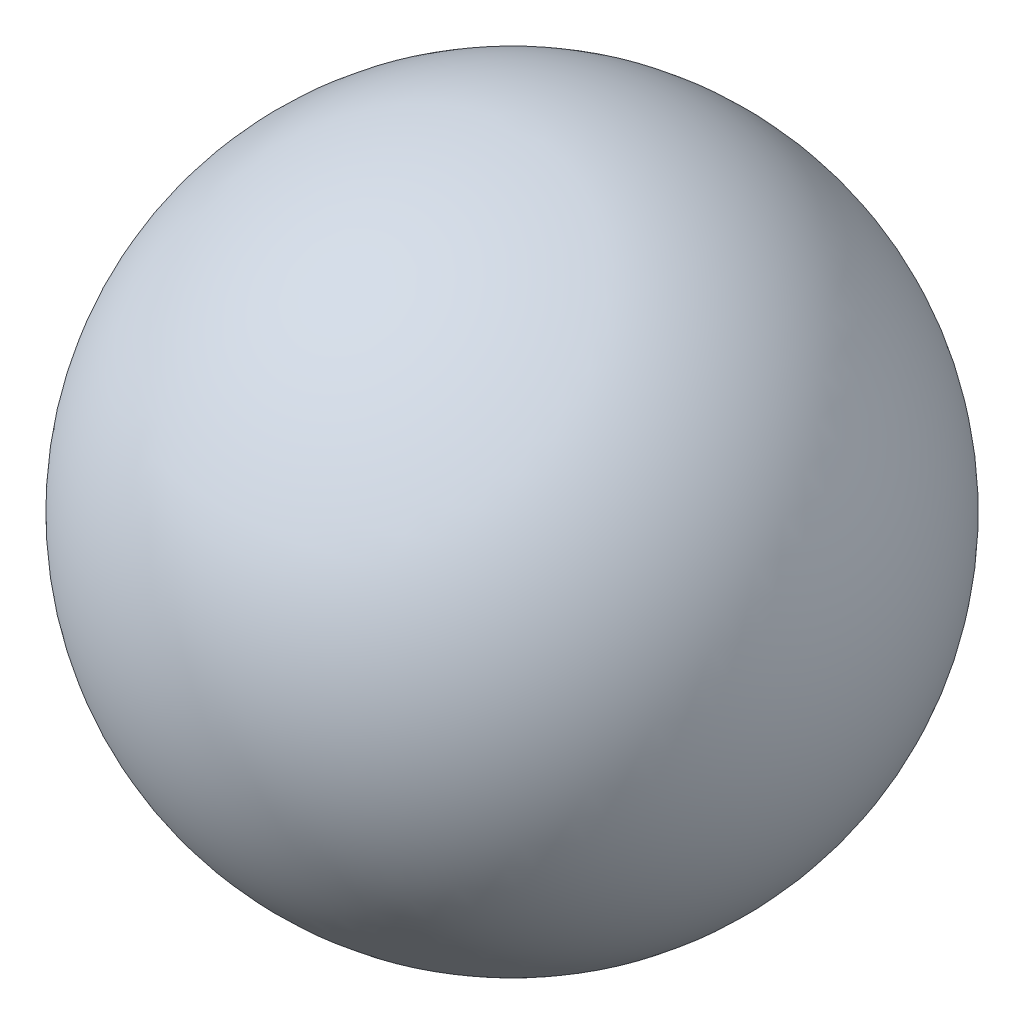
from build123d import *


with BuildPart() as part:
    # 草图1 → 旋转1 (revolve)
    with BuildSketch(Plane(origin=(0, 0, 0), x_dir=(0, 0, -1), z_dir=(1, 0, 0))):
        with BuildLine():
            Line((0, -10), (0, 20))
            ThreePointArc((0, 20), (15, 5), (0, -10))
        make_face()
    revolve(axis=Axis((0, -10, 0), (0, 1, 0)))


solid = part.part
